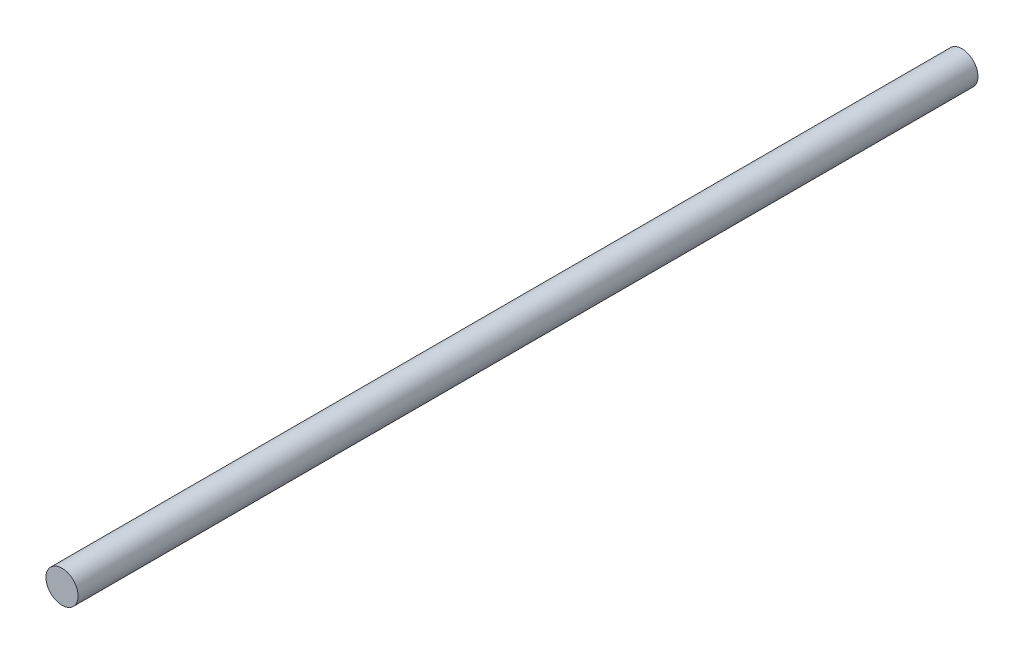
from build123d import *

# Parameters (mm, degrees)
SKETCH_1_R      = 5
EXTRUDE_1_DEPTH = 280


with BuildPart() as part:
    # 草图1 → 凸台-拉伸1 (new body)
    with BuildSketch(Plane.XY):
        Circle(SKETCH_1_R)
    extrude(amount=EXTRUDE_1_DEPTH)


solid = part.part
